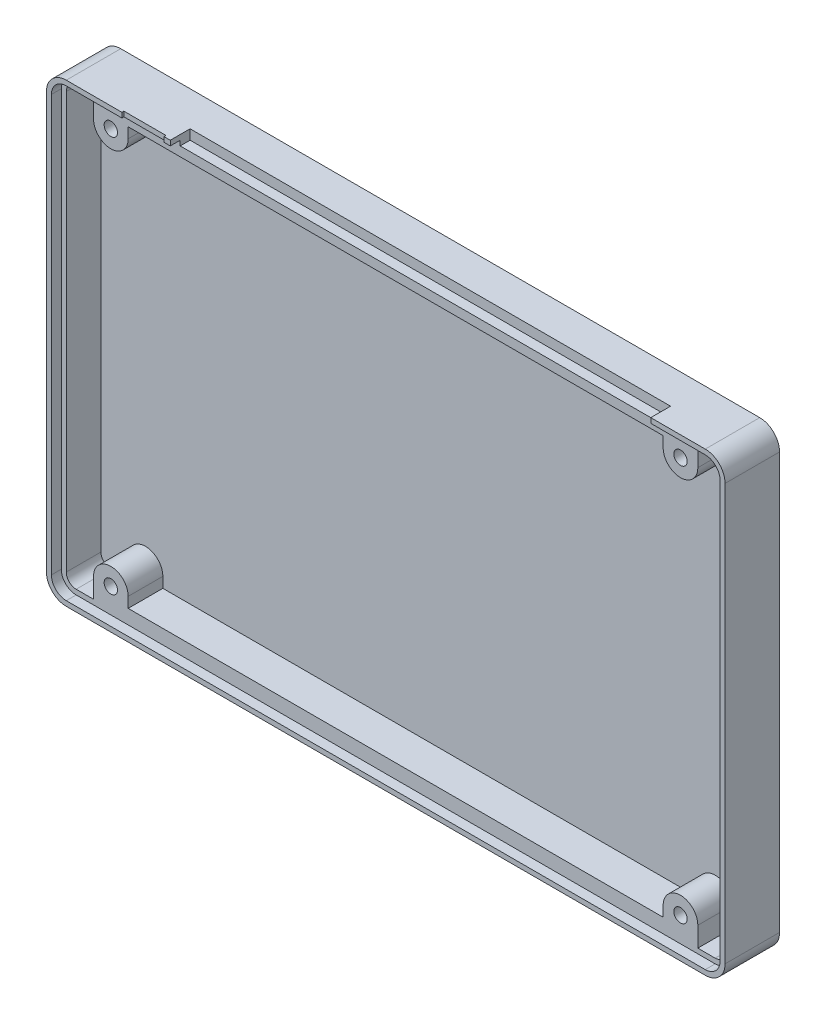
from build123d import *

# Parameters (mm, degrees)
SKETCH1_W           = 137
SKETCH1_H           = 92
BOSS_EXTRUDE1_DEPTH = 2
SKETCH2_W           = 137
SKETCH2_H           = 92
SKETCH2_W_2         = 133
SKETCH2_H_2         = 88
BOSS_EXTRUDE2_DEPTH = 7
SKETCH3_W           = 137
SKETCH3_H           = 92
SKETCH3_W_2         = 135
SKETCH3_H_2         = 90
BOSS_EXTRUDE3_DEPTH = 2
SKETCH4_R           = 1.35
BOSS_EXTRUDE4_DEPTH = 7
SKETCH8_W           = 108
SKETCH8_H           = 1.9
BOSS_EXTRUDE6_DEPTH = 7
FILLET1_R           = 2
FILLET2_R           = 3
FILLET3_R           = 4
SKETCH11_W          = 108
SKETCH11_H          = 1.9
BOSS_EXTRUDE7_DEPTH = 7
SKETCH12_W          = 97
SKETCH12_H          = 4
CUT_EXTRUDE3_DEPTH  = 2
CUT_EXTRUDE4_START  = -10
SKETCH13_R          = 1.35
CUT_EXTRUDE4_DEPTH  = 10
SKETCH14_W          = 8.5
SKETCH14_H          = 0.4
CUT_EXTRUDE5_DEPTH  = 2
SKETCH16_R          = 3
CUT_EXTRUDE12_DEPTH = 2


with BuildPart() as part:
    # Sketch1 → Boss-Extrude1 (new body)
    with BuildSketch(Plane.XY):
        with Locations((68.5, 46)):
            Rectangle(SKETCH1_W, SKETCH1_H)
    extrude(amount=BOSS_EXTRUDE1_DEPTH)

    # Sketch2 → Boss-Extrude2 (add)
    with BuildSketch(Plane.XY.offset(2)):
        with Locations((68.5, 46)):
            Rectangle(SKETCH2_W, SKETCH2_H)
        with Locations((68.5, 46)):
            Rectangle(SKETCH2_W_2, SKETCH2_H_2, mode=Mode.SUBTRACT)
    extrude(amount=BOSS_EXTRUDE2_DEPTH)

    # Sketch3 → Boss-Extrude3 (add)
    with BuildSketch(Plane.XY.offset(9)):
        with Locations((68.5, 46)):
            Rectangle(SKETCH3_W, SKETCH3_H)
        with Locations((68.5, 46)):
            Rectangle(SKETCH3_W_2, SKETCH3_H_2, mode=Mode.SUBTRACT)
    extrude(amount=BOSS_EXTRUDE3_DEPTH)

    # Sketch4 → Boss-Extrude4 (add)
    # profile 1 of 4: a face of its own
    with BuildSketch(Plane.XY.offset(2)):
        with BuildLine():
            Line((7.5, 6), (7.5, 2))
            Line((7.5, 2), (14.5, 2))
            Line((14.5, 2), (14.5, 6))
            ThreePointArc((14.5, 6), (11, 9.5), (7.5, 6))
        make_face()
        with Locations((11, 6)):
            Circle(SKETCH4_R, mode=Mode.SUBTRACT)
    # profile 2 of 4: a face of its own
    with BuildSketch(Plane.XY.offset(2)):
        with BuildLine():
            Line((122.5, 6), (122.5, 2))
            Line((122.5, 2), (129.5, 2))
            Line((129.5, 2), (129.5, 6))
            ThreePointArc((129.5, 6), (126, 9.5), (122.5, 6))
        make_face()
        with Locations((126, 6)):
            Circle(SKETCH4_R, mode=Mode.SUBTRACT)
    # profile 3 of 4: a face of its own
    with BuildSketch(Plane.XY.offset(2)):
        with BuildLine():
            Line((129.5, 86), (129.5, 90))
            Line((129.5, 90), (122.5, 90))
            Line((122.5, 90), (122.5, 86))
            ThreePointArc((122.5, 86), (126, 82.5), (129.5, 86))
        make_face()
        with Locations((126, 86)):
            Circle(SKETCH4_R, mode=Mode.SUBTRACT)
    # profile 4 of 4: a face of its own
    with BuildSketch(Plane.XY.offset(2)):
        with BuildLine():
            Line((14.5, 86), (14.5, 90))
            Line((14.5, 90), (7.5, 90))
            Line((7.5, 90), (7.5, 86))
            ThreePointArc((7.5, 86), (11, 82.5), (14.5, 86))
        make_face()
        with Locations((11, 86)):
            Circle(SKETCH4_R, mode=Mode.SUBTRACT)
    extrude(amount=BOSS_EXTRUDE4_DEPTH)

    # Sketch8 → Boss-Extrude6 (add)
    with BuildSketch(Plane.XY.offset(2)):
        with Locations((68.5, 2.95)):
            Rectangle(SKETCH8_W, SKETCH8_H)
    extrude(amount=BOSS_EXTRUDE6_DEPTH)

    # Fillet1
    fillet1_edges = [part.edges().sort_by_distance(p)[0] for p in [
        (2, 2, 5.5),
        (135, 2, 5.5),
        (135, 90, 5.5),
        (2, 90, 5.5),
    ]]
    fillet(fillet1_edges, radius=FILLET1_R)

    # Fillet2
    fillet2_edges = [part.edges().sort_by_distance(p)[0] for p in [
        (1, 1, 10),
        (136, 1, 10),
        (136, 91, 10),
        (1, 91, 10),
    ]]
    fillet(fillet2_edges, radius=FILLET2_R)

    # Fillet3
    fillet3_edges = [part.edges().sort_by_distance(p)[0] for p in [
        (0, 92, 5.5),
        (137, 92, 5.5),
        (137, 0, 5.5),
        (0, 0, 5.5),
    ]]
    fillet(fillet3_edges, radius=FILLET3_R)

    # Sketch11 → Boss-Extrude7 (add)
    with BuildSketch(Plane.XY.offset(2)):
        with Locations((68.5, 89.05)):
            Rectangle(SKETCH11_W, SKETCH11_H)
    extrude(amount=BOSS_EXTRUDE7_DEPTH)

    # Sketch12 → Cut-Extrude3 (cut)
    with BuildSketch(Plane(origin=(0, 92, 0), x_dir=(1, 0, 0), z_dir=(0, 1, 0))):
        with Locations((73.5, -9)):
            Rectangle(SKETCH12_W, SKETCH12_H)
    extrude(amount=-CUT_EXTRUDE3_DEPTH, mode=Mode.SUBTRACT)

    # Sketch13 → Cut-Extrude4 (cut)
    with BuildSketch(Plane.XY.offset(9).offset(CUT_EXTRUDE4_START)):
        with Locations(Location((11, 86, 0), (0, 0, 180))):
            Circle(SKETCH13_R)
        with Locations(Location((11, 6, 0), (0, 0, 180))):
            Circle(SKETCH13_R)
        with Locations(Location((126, 6, 0), (0, 0, 180))):
            Circle(SKETCH13_R)
        with Locations(Location((126, 86, 0), (0, 0, 180))):
            Circle(SKETCH13_R)
    extrude(amount=CUT_EXTRUDE4_DEPTH, mode=Mode.SUBTRACT)

    # Sketch14 → Cut-Extrude5 (cut)
    with BuildSketch(Plane(origin=(0, 92, 0), x_dir=(1, 0, 0), z_dir=(0, 1, 0))):
        with Locations((19.488221945, -10.8)):
            Rectangle(SKETCH14_W, SKETCH14_H)
    extrude(amount=-CUT_EXTRUDE5_DEPTH, mode=Mode.SUBTRACT)

    # Sketch16 → Cut-Extrude12 (cut)
    with BuildSketch(Plane(origin=(0, 0, 0), x_dir=(-1, 0, 0), z_dir=(0, 0, -1))):
        with Locations((-126, 86)):
            Circle(SKETCH16_R)
        with Locations((-11, 86)):
            Circle(SKETCH16_R)
        with Locations((-11, 6)):
            Circle(SKETCH16_R)
        with Locations((-126, 6)):
            Circle(SKETCH16_R)
    extrude(amount=-CUT_EXTRUDE12_DEPTH, mode=Mode.SUBTRACT)


solid = part.part
